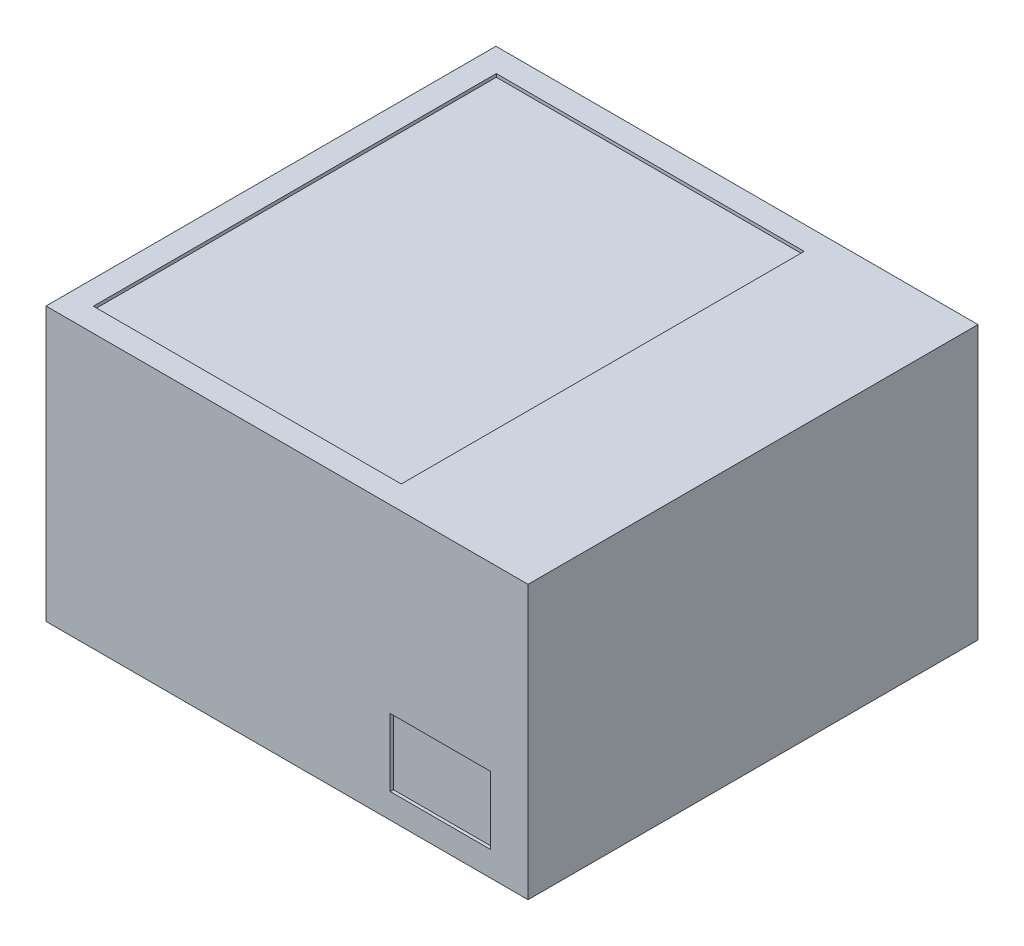
from build123d import *

# Parameters (mm, degrees)
SKETCH1_W           = 150
SKETCH1_H           = 140
BOSS_EXTRUDE1_DEPTH = 85
SKETCH2_W           = 31.205424041
SKETCH2_H           = 21.045678937
CUT_EXTRUDE1_DEPTH  = 1
SKETCH3_W           = 95.813101978
SKETCH3_H           = 125.386699306
CUT_EXTRUDE2_DEPTH  = 1


with BuildPart() as part:
    # Sketch1 → Boss-Extrude1 (new body)
    with BuildSketch(Plane(origin=(0, 0, 0), x_dir=(1, 0, 0), z_dir=(0, 1, 0))):
        Rectangle(SKETCH1_W, SKETCH1_H)
    extrude(amount=BOSS_EXTRUDE1_DEPTH)

    # Sketch2 → Cut-Extrude1 (cut)
    with BuildSketch(Plane.XY.offset(70)):
        with Locations((47.705903702, 18.235389002)):
            Rectangle(SKETCH2_W, SKETCH2_H)
    extrude(amount=-CUT_EXTRUDE1_DEPTH, mode=Mode.SUBTRACT)

    # Sketch3 → Cut-Extrude2 (cut)
    with BuildSketch(Plane(origin=(0, 85, 0), x_dir=(1, 0, 0), z_dir=(0, 1, 0))):
        with Locations((-19.67334308, 0)):
            Rectangle(SKETCH3_W, SKETCH3_H)
    extrude(amount=-CUT_EXTRUDE2_DEPTH, mode=Mode.SUBTRACT)


solid = part.part
